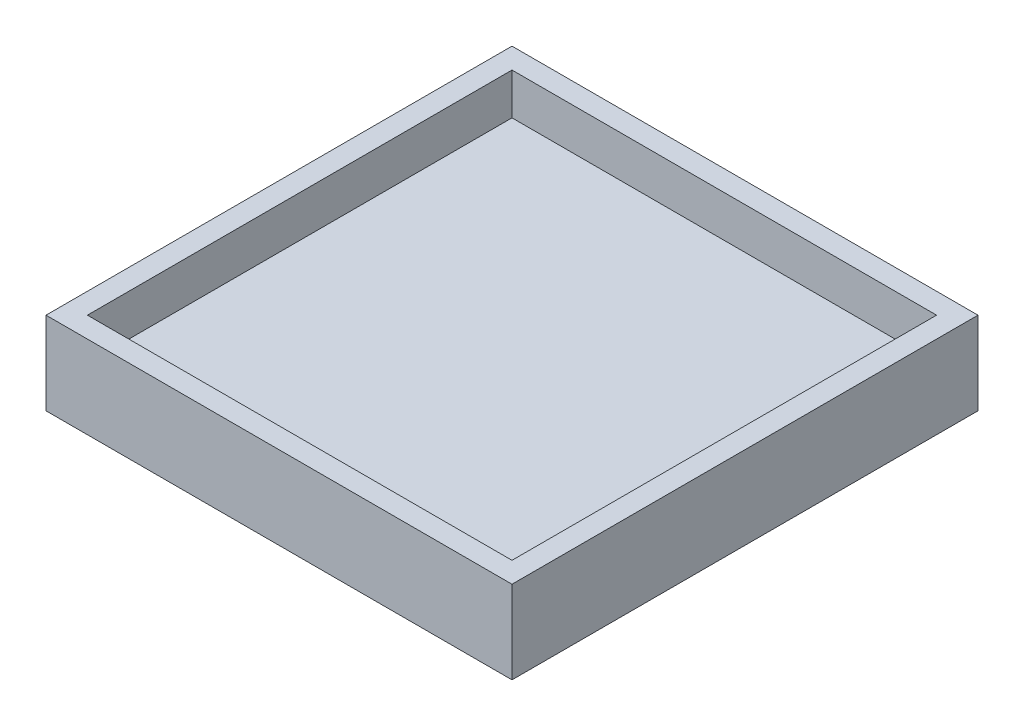
from build123d import *

# Parameters (mm, degrees)
SKETCH1_W           = 225
SKETCH1_H           = 225
SKETCH1_W_2         = 205
SKETCH1_H_2         = 205
WALLS_DEPTH         = 40
SKETCH1_5_W         = 205
SKETCH1_5_H         = 205
BOSS_EXTRUDE2_DEPTH = 20


with BuildPart() as part:
    # Sketch1 → Walls (new body)
    with BuildSketch(Plane(origin=(0, 0, 0), x_dir=(1, 0, 0), z_dir=(0, 1, 0))):
        with Locations((-20.5, -12.5)):
            Rectangle(SKETCH1_W, SKETCH1_H)
        with Locations((-20.5, -12.5)):
            Rectangle(SKETCH1_W_2, SKETCH1_H_2, mode=Mode.SUBTRACT)
    extrude(amount=WALLS_DEPTH)

    # Sketch1<5> → Boss-Extrude2 (add)
    with BuildSketch(Plane(origin=(0, 0, 0), x_dir=(1, 0, 0), z_dir=(0, 1, 0))):
        with Locations((-20.5, -12.5)):
            Rectangle(SKETCH1_5_W, SKETCH1_5_H)
    extrude(amount=BOSS_EXTRUDE2_DEPTH)


solid = part.part
